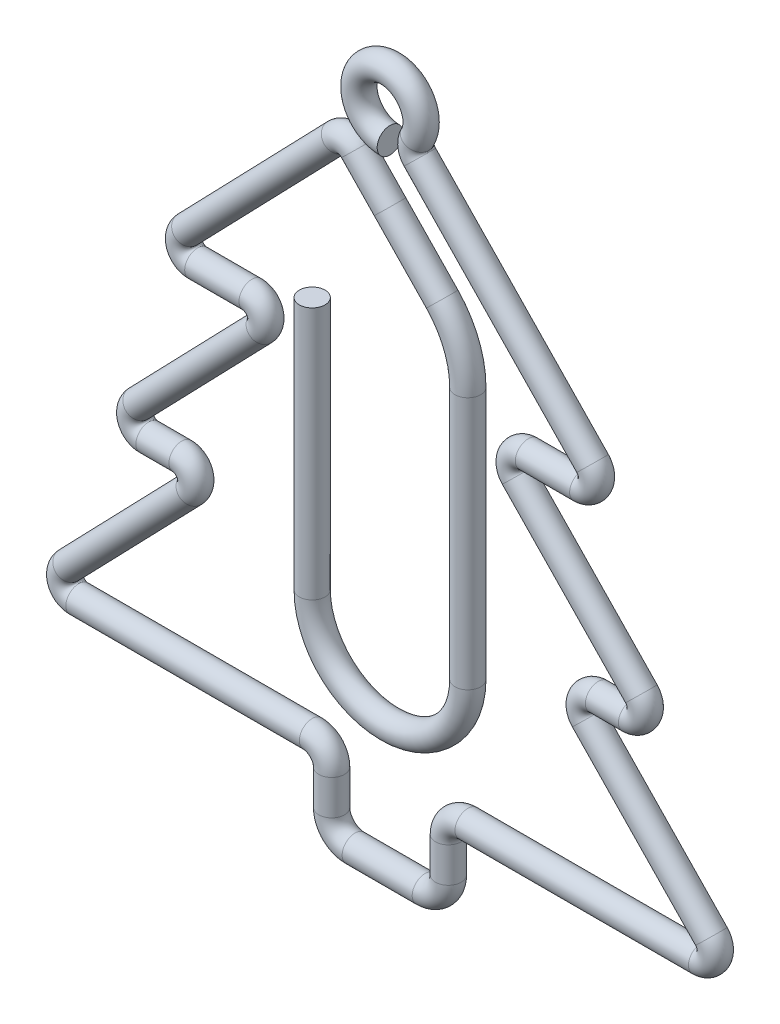
from build123d import *

# Parameters (mm, degrees)
SKETCH_2_R = 3.3


with BuildPart() as part:
    # По траектории4: sweep along a path in Эскиз1
    with BuildLine(Plane.XY) as sweep_4_path:
        Line((-20, -53), (-20, -118))
        ThreePointArc((-20, -118), (0, -138), (20, -118))
        Line((20, -118), (20, -53))
        ThreePointArc((20, -53), (18.286457723, -44.184589198), (13.39537798, -36.652986866))
        Line((13.39537798, -36.652986866), (0, -22.781666903))
        Line((0, -22.781666903), (-8.410376719, -14.072466861))
        ThreePointArc((-8.410376719, -14.072466861), (-11, -12.973236994), (-13.589623281, -14.072466861))
        Line((-13.589623281, -14.072466861), (-52.049881253, -53.899229866))
        ThreePointArc((-52.049881253, -53.899229866), (-52.774075444, -57.806632063), (-49.460257971, -60))
        Line((-49.460257971, -60), (-35.506142168, -60))
        ThreePointArc((-35.506142168, -60), (-32.192324695, -62.193367937), (-32.916518886, -66.100770134))
        Line((-32.916518886, -66.100770134), (-64.589623281, -98.899229866))
        ThreePointArc((-64.589623281, -98.899229866), (-65.313817472, -102.806632063), (-62, -105))
        Line((-62, -105), (-53.506142168, -105))
        ThreePointArc((-53.506142168, -105), (-50.192324695, -107.193367937), (-50.916518886, -111.100770134))
        Line((-50.916518886, -111.100770134), (-82.589623281, -143.899229866))
        ThreePointArc((-82.589623281, -143.899229866), (-83.313817472, -147.806632063), (-80, -150))
        Line((-80, -150), (-20, -150))
        ThreePointArc((-20, -150), (-16.464466094, -151.464466094), (-15, -155))
        Line((-15, -155), (-15, -164))
        ThreePointArc((-15, -164), (-13.242640687, -168.242640687), (-9, -170))
        Line((-9, -170), (9, -170))
        ThreePointArc((9, -170), (13.242640687, -168.242640687), (15, -164))
        Line((15, -164), (15, -155))
        ThreePointArc((15, -155), (16.464466094, -151.464466094), (20, -150))
        Line((20, -150), (80, -150))
        ThreePointArc((80, -150), (83.313817472, -147.806632063), (82.589623281, -143.899229866))
        Line((82.589623281, -143.899229866), (50.916518886, -111.100770134))
        ThreePointArc((50.916518886, -111.100770134), (50.192324695, -107.193367937), (53.506142168, -105))
        Line((53.506142168, -105), (62, -105))
        ThreePointArc((62, -105), (65.313817472, -102.806632063), (64.589623281, -98.899229866))
        Line((64.589623281, -98.899229866), (32.916518886, -66.100770134))
        ThreePointArc((32.916518886, -66.100770134), (32.192324695, -62.193367937), (35.506142168, -60))
        Line((35.506142168, -60), (49.460257971, -60))
        ThreePointArc((49.460257971, -60), (52.774075444, -57.806632063), (52.049881253, -53.899229866))
        Line((52.049881253, -53.899229866), (7.660163876, -7.932331902))
        ThreePointArc((7.660163876, -7.932331902), (6.685172814, -5.935074017), (7.068818729, -3.745904668))
        ThreePointArc((7.068818729, -3.745904668), (-4.125091675, 6.854459765), (0, -8))
    # Эскиз2 → По траектории4 (sweep)
    with BuildSketch(Plane(origin=(0, -8, 0), x_dir=(0, 0, 1), z_dir=(-1, 0, 0))):
        Circle(SKETCH_2_R)
    sweep(path=sweep_4_path.line)


solid = part.part
